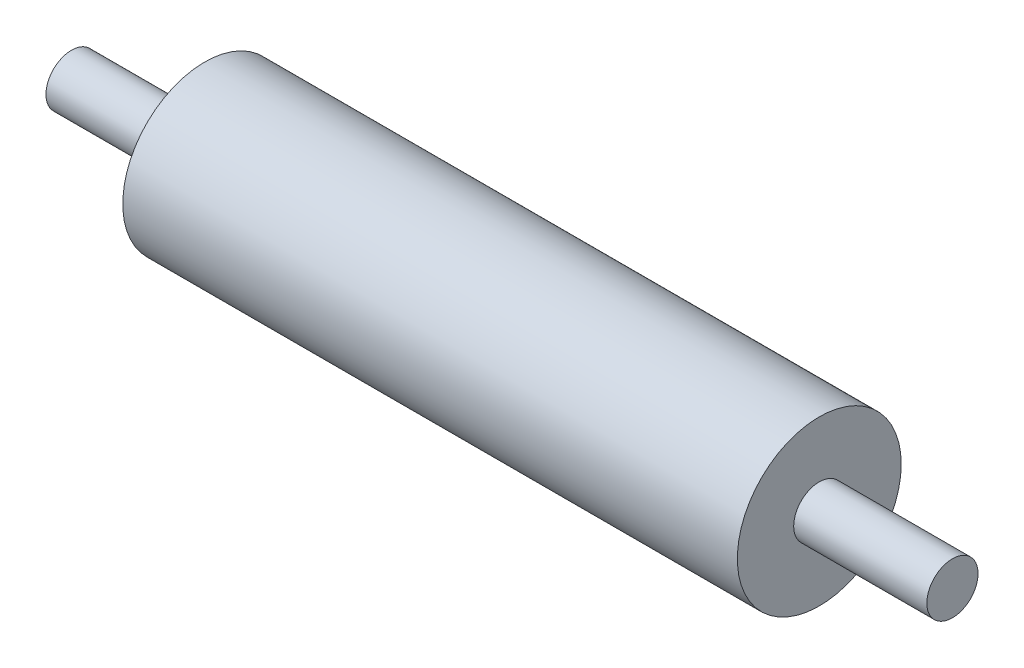
from build123d import *

# Parameters (mm, degrees)
SKETCH1_R           = 8
BOSS_EXTRUDE1_DEPTH = 30
SKETCH2_R           = 2.5
BOSS_EXTRUDE2_DEPTH = 13


with BuildPart() as part:
    # Sketch1 → Boss-Extrude1 (new body)
    with BuildSketch(Plane(origin=(0, 0, 0), x_dir=(0, 0, -1), z_dir=(1, 0, 0))):
        Circle(SKETCH1_R)
    boss_extrude1 = extrude(amount=BOSS_EXTRUDE1_DEPTH)

    # Sketch2 → Boss-Extrude2 (add)
    with BuildSketch(Plane(origin=(30, 0, 0), x_dir=(0, 0, -1), z_dir=(1, 0, 0))):
        with Locations(Location((0, 0, 0), (0, 0, 180))):
            Circle(SKETCH2_R)
    boss_extrude2 = extrude(amount=BOSS_EXTRUDE2_DEPTH)

    # Mirror1: Boss-Extrude1, Boss-Extrude2 across plane
    add(boss_extrude1.mirror(Plane(origin=(0, 0, 0), x_dir=(0, 0, 1), z_dir=(1, 0, 0))))
    add(boss_extrude2.mirror(Plane(origin=(0, 0, 0), x_dir=(0, 0, 1), z_dir=(1, 0, 0))))


solid = part.part
